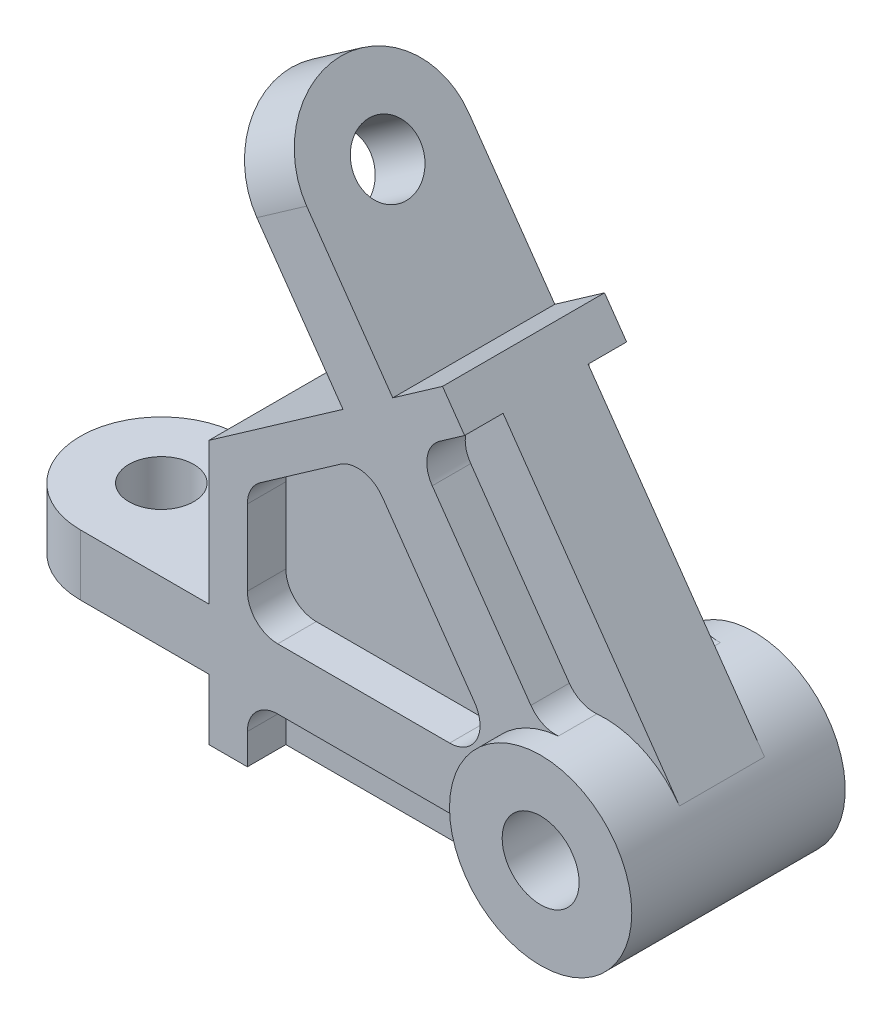
from build123d import *

# Parameters (mm, degrees)
BOSS_EXTRU_1_DEPTH      = 40
ESQUISSE2_R             = 8
ENL_V_MAT_EXTRU_1_DEPTH = 192.268559563
ESQUISSE3_R             = 8
ENL_V_MAT_EXTRU_2_DEPTH = 185.632839971
BOSS_EXTRU_2_DEPTH      = 6.35
BOSS_EXTRU_3_START      = 6.35
BOSS_EXTRU_3_DEPTH      = 6.35
ENL_V_START             = -9.5
ENL_V_MAT_EXTRU_3_DEPTH = 9.5
ENL_V_MAT_EXTRU_4_DEPTH = 9.5


with BuildPart() as part:
    # Esquisse1 → Boss.-Extru.1 (new body)
    with BuildSketch(Plane.XY):
        with BuildLine():
            ThreePointArc((-12.905469818, 18.430920997), (3.907083998, 22.158174443), (18.430920997, 12.905469818))
            Line((18.430920997, 12.905469818), (-30.570908371, 82.887334756))
            Line((-30.570908371, 82.887334756), (-42.858189035, 74.28368821))
            Line((-42.858189035, 74.28368821), (-75.591001848, 121.030989584))
            Line((-75.591001848, 121.030989584), (-81.73464218, 116.729166311))
            Line((-81.73464218, 116.729166311), (-12.905469818, 18.430920997))
        make_face()
        with BuildLine():
            ThreePointArc((-22.5, 0), (-19.957743747, 10.389343798), (-12.905469818, 18.430920997))
            Line((-12.905469818, 18.430920997), (-81.73464218, 116.729166311))
            Line((-81.73464218, 116.729166311), (-87.878282512, 112.427343039))
            Line((-87.878282512, 112.427343039), (-55.1454697, 65.680041665))
            Line((-55.1454697, 65.680041665), (-88.25, 42.5))
            Line((-88.25, 42.5), (-88.25, 7.5))
            Line((-88.25, 7.5), (-140, 7.5))
            Line((-140, 7.5), (-140, 0))
            Line((-140, 0), (-22.5, 0))
        make_face()
        with BuildLine():
            Line((-88.25, -22.560492565), (0.015421683, -22.499994715))
            ThreePointArc((0.015421683, -22.499994715), (-15.904449254, -15.915354031), (-22.5, 0))
            Line((-22.5, 0), (-140, 0))
            Line((-140, 0), (-140, -7.5))
            Line((-140, -7.5), (-88.25, -7.5))
            Line((-88.25, -7.5), (-88.25, -22.560492565))
        make_face()
        with BuildLine():
            ThreePointArc((22.5, 0), (21.458631392, 6.765880489), (18.430920997, 12.905469818))
            ThreePointArc((18.430920997, 12.905469818), (3.907083998, 22.158174443), (-12.905469818, 18.430920997))
            Line((-12.905469818, 18.430920997), (-5.448976145, 7.781944421))
            ThreePointArc((-5.448976145, 7.781944421), (4.386611826, 8.426602915), (9.5, 0))
            ThreePointArc((9.5, 0), (0, -9.5), (-9.5, 0))
            Line((-9.5, 0), (-22.5, 0))
            ThreePointArc((-22.5, 0), (-15.904449254, -15.915354031), (0.015421683, -22.499994715))
            ThreePointArc((0.015421683, -22.499994715), (15.915354031, -15.904449254), (22.5, 0))
        make_face()
        with BuildLine():
            Line((-5.448976145, 7.781944421), (-12.905469818, 18.430920997))
            ThreePointArc((-12.905469818, 18.430920997), (-19.957743747, 10.389343798), (-22.5, 0))
            Line((-22.5, 0), (-9.5, 0))
            ThreePointArc((-9.5, 0), (-8.426602915, 4.386611826), (-5.448976145, 7.781944421))
        make_face()
        with BuildLine():
            ThreePointArc((22.5, 0), (21.458631392, 6.765880489), (18.430920997, 12.905469818))
            ThreePointArc((18.430920997, 12.905469818), (3.907083998, 22.158174443), (-12.905469818, 18.430920997))
            Line((-12.905469818, 18.430920997), (-5.448976145, 7.781944421))
            ThreePointArc((-5.448976145, 7.781944421), (4.386611826, 8.426602915), (9.5, 0))
            ThreePointArc((9.5, 0), (0, -9.5), (-9.5, 0))
            Line((-9.5, 0), (-22.5, 0))
            ThreePointArc((-22.5, 0), (-15.904449254, -15.915354031), (0.015421683, -22.499994715))
            ThreePointArc((0.015421683, -22.499994715), (15.915354031, -15.904449254), (22.5, 0))
        make_face()
        with BuildLine():
            Line((-5.448976145, 7.781944421), (-12.905469818, 18.430920997))
            ThreePointArc((-12.905469818, 18.430920997), (-19.957743747, 10.389343798), (-22.5, 0))
            Line((-22.5, 0), (-9.5, 0))
            ThreePointArc((-9.5, 0), (-8.426602915, 4.386611826), (-5.448976145, 7.781944421))
        make_face()
    extrude(amount=BOSS_EXTRU_1_DEPTH)

    # Esquisse2 → Enlèv. mat.-Extru.1 (cut, through all)
    with BuildSketch(Plane(origin=(6.143640332, 4.301823273, 0), x_dir=(0, 0, -1), z_dir=(0.8191520442889931, 0.5735764363510444, 0))):
        with Locations(Location((-20, 122.5, 0), (0, 0, 90))):
            Circle(ESQUISSE2_R)
        with BuildLine():
            ThreePointArc((-40, 122.5), (-34.142135624, 136.642135624), (-20, 142.5))
            Line((-20, 142.5), (-40, 142.5))
            Line((-40, 142.5), (-40, 122.5))
        make_face()
        with BuildLine():
            ThreePointArc((-20, 142.5), (-5.857864376, 136.642135624), (0, 122.5))
            Line((0, 122.5), (0, 142.5))
            Line((0, 142.5), (-20, 142.5))
        make_face()
    extrude(amount=-ENL_V_MAT_EXTRU_1_DEPTH, mode=Mode.SUBTRACT)

    # Esquisse3 → Enlèv. mat.-Extru.2 (cut, through all)
    with BuildSketch(Plane(origin=(0, 7.5, 0), x_dir=(1, 0, 0), z_dir=(0, 1, 0))):
        with BuildLine():
            ThreePointArc((-140, -20), (-134.142135624, -5.857864376), (-120, 0))
            Line((-120, 0), (-140, 0))
            Line((-140, 0), (-140, -20))
        make_face()
        with BuildLine():
            ThreePointArc((-120, -40), (-134.142135624, -34.142135624), (-140, -20))
            Line((-140, -20), (-140, -40))
            Line((-140, -40), (-120, -40))
        make_face()
        with Locations(Location((-120, -20, 0), (0, 0, 180))):
            Circle(ESQUISSE3_R)
    extrude(amount=-ENL_V_MAT_EXTRU_2_DEPTH, mode=Mode.SUBTRACT)

    # Esquisse4 → Boss.-Extru.2 (add)
    with BuildSketch(Plane.XY.offset(40)):
        with BuildLine():
            ThreePointArc((22.5, 0), (21.458631392, 6.765880489), (18.430920997, 12.905469818))
            ThreePointArc((18.430920997, 12.905469818), (3.907083998, 22.158174443), (-12.905469818, 18.430920997))
            Line((-12.905469818, 18.430920997), (-5.448976145, 7.781944421))
            ThreePointArc((-5.448976145, 7.781944421), (4.386611826, 8.426602915), (9.5, 0))
            ThreePointArc((9.5, 0), (0, -9.5), (-9.5, 0))
            Line((-9.5, 0), (-22.5, 0))
            ThreePointArc((-22.5, 0), (-15.904449254, -15.915354031), (0.015421683, -22.499994715))
            ThreePointArc((0.015421683, -22.499994715), (15.915354031, -15.904449254), (22.5, 0))
        make_face()
        with BuildLine():
            ThreePointArc((22.5, 0), (21.458631392, 6.765880489), (18.430920997, 12.905469818))
            ThreePointArc((18.430920997, 12.905469818), (3.907083998, 22.158174443), (-12.905469818, 18.430920997))
            Line((-12.905469818, 18.430920997), (-5.448976145, 7.781944421))
            ThreePointArc((-5.448976145, 7.781944421), (4.386611826, 8.426602915), (9.5, 0))
            ThreePointArc((9.5, 0), (0, -9.5), (-9.5, 0))
            Line((-9.5, 0), (-22.5, 0))
            ThreePointArc((-22.5, 0), (-15.904449254, -15.915354031), (0.015421683, -22.499994715))
            ThreePointArc((0.015421683, -22.499994715), (15.915354031, -15.904449254), (22.5, 0))
        make_face()
        with BuildLine():
            Line((-5.448976145, 7.781944421), (-12.905469818, 18.430920997))
            ThreePointArc((-12.905469818, 18.430920997), (-19.957743747, 10.389343798), (-22.5, 0))
            Line((-22.5, 0), (-9.5, 0))
            ThreePointArc((-9.5, 0), (-8.426602915, 4.386611826), (-5.448976145, 7.781944421))
        make_face()
    extrude(amount=BOSS_EXTRU_2_DEPTH)

    # Esquisse5 → Boss.-Extru.3 (add)
    with BuildSketch(Plane(origin=(0, 0, 0), x_dir=(-1, 0, 0), z_dir=(0, 0, -1)).offset(BOSS_EXTRU_3_START)):
        with BuildLine():
            ThreePointArc((12.905469818, 18.430920997), (-3.907083998, 22.158174443), (-18.430920997, 12.905469818))
            ThreePointArc((-18.430920997, 12.905469818), (-19.961303045, -10.382503588), (-0.015421683, -22.499994715))
            ThreePointArc((-0.015421683, -22.499994715), (15.904449254, -15.915354031), (22.5, 0))
            Line((22.5, 0), (9.5, 0))
            ThreePointArc((9.5, 0), (-8.426602915, -4.386611826), (5.448976145, 7.781944421))
            Line((5.448976145, 7.781944421), (12.905469818, 18.430920997))
        make_face()
        with BuildLine():
            ThreePointArc((22.5, 0), (19.957743747, 10.389343798), (12.905469818, 18.430920997))
            Line((12.905469818, 18.430920997), (5.448976145, 7.781944421))
            ThreePointArc((5.448976145, 7.781944421), (8.426602915, 4.386611826), (9.5, 0))
            Line((9.5, 0), (22.5, 0))
        make_face()
        with BuildLine():
            ThreePointArc((12.905469818, 18.430920997), (-3.907083998, 22.158174443), (-18.430920997, 12.905469818))
            ThreePointArc((-18.430920997, 12.905469818), (-19.961303045, -10.382503588), (-0.015421683, -22.499994715))
            ThreePointArc((-0.015421683, -22.499994715), (15.904449254, -15.915354031), (22.5, 0))
            Line((22.5, 0), (9.5, 0))
            ThreePointArc((9.5, 0), (-8.426602915, -4.386611826), (5.448976145, 7.781944421))
            Line((5.448976145, 7.781944421), (12.905469818, 18.430920997))
        make_face()
    extrude(amount=-BOSS_EXTRU_3_DEPTH)

    # Esquisse6 → Enlèv. mat.-Extru.3 (cut)
    with BuildSketch(Plane.XY.offset(40).offset(ENL_V_START)):
        with BuildLine():
            Line((18.430920997, 12.905469818), (-25.121932226, 75.105390335))
            Line((-25.121932226, 75.105390335), (-31.265572558, 70.803567062))
            ThreePointArc((-31.265572558, 70.803567062), (-34.349807433, 65.962288063), (-33.107389617, 60.358103458))
            Line((-33.107389617, 60.358103458), (-8.758312615, 25.58401767))
            ThreePointArc((-8.758312615, 25.58401767), (-5.784309245, 23.08853254), (-1.961004212, 22.414380707))
            ThreePointArc((-1.961004212, 22.414380707), (9.508910889, 20.391925208), (18.430920997, 12.905469818))
        make_face()
        with BuildLine():
            Line((-78.75, -22.553981187), (0.015421683, -22.499994715))
            ThreePointArc((0.015421683, -22.499994715), (-11.243321555, -19.489425862), (-19.485571585, -11.25))
            ThreePointArc((-19.485571585, -11.25), (-22.230762114, -8.504809472), (-25.980762114, -7.5))
            Line((-25.980762114, -7.5), (-71.25, -7.5))
            ThreePointArc((-71.25, -7.5), (-76.553300859, -9.696699141), (-78.75, -15))
            Line((-78.75, -15), (-78.75, -22.553981187))
        make_face()
        with BuildLine():
            Line((-22.671091572, 19.301823273), (-45.394670282, 51.754456912))
            ThreePointArc((-45.394670282, 51.754456912), (-50.235949281, 54.838691787), (-55.840133886, 53.596273972))
            Line((-55.840133886, 53.596273972), (-75.551823273, 39.794000473))
            ThreePointArc((-75.551823273, 39.794000473), (-77.902581249, 37.11347474), (-78.75, 33.650360141))
            Line((-78.75, 33.650360141), (-78.75, 15))
            ThreePointArc((-78.75, 15), (-76.553300859, 9.696699141), (-71.25, 7.5))
            Line((-71.25, 7.5), (-28.814731905, 7.5))
            ThreePointArc((-28.814731905, 7.5), (-22.162150656, 11.536885401), (-22.671091572, 19.301823273))
        make_face()
    extrude(amount=ENL_V_MAT_EXTRU_3_DEPTH, mode=Mode.SUBTRACT)

    # Esquisse7 → Enlèv. mat.-Extru.4 (cut)
    with BuildSketch(Plane(origin=(0, 0, 0), x_dir=(-1, 0, 0), z_dir=(0, 0, -1))):
        with BuildLine():
            Line((25.980762114, -7.5), (71.25, -7.5))
            ThreePointArc((71.25, -7.5), (76.553300859, -9.696699141), (78.75, -15))
            Line((78.75, -15), (78.75, -22.553981187))
            Line((78.75, -22.553981187), (-0.015421683, -22.499994715))
            ThreePointArc((-0.015421683, -22.499994715), (11.243321555, -19.489425862), (19.485571585, -11.25))
            ThreePointArc((19.485571585, -11.25), (22.230762114, -8.504809472), (25.980762114, -7.5))
        make_face()
        with BuildLine():
            Line((33.107389617, 60.358103458), (8.758312615, 25.58401767))
            ThreePointArc((8.758312615, 25.58401767), (5.784309245, 23.08853254), (1.961004212, 22.414380707))
            ThreePointArc((1.961004212, 22.414380707), (-9.508910889, 20.391925208), (-18.430920997, 12.905469818))
            Line((-18.430920997, 12.905469818), (25.121932226, 75.105390335))
            Line((25.121932226, 75.105390335), (31.265572558, 70.803567062))
            ThreePointArc((31.265572558, 70.803567062), (34.349807433, 65.962288063), (33.107389617, 60.358103458))
        make_face()
        with BuildLine():
            Line((78.75, 33.650360141), (78.75, 15))
            ThreePointArc((78.75, 15), (76.553300859, 9.696699141), (71.25, 7.5))
            Line((71.25, 7.5), (28.814731905, 7.5))
            ThreePointArc((28.814731905, 7.5), (22.162150656, 11.536885401), (22.671091572, 19.301823273))
            Line((22.671091572, 19.301823273), (45.394670282, 51.754456912))
            ThreePointArc((45.394670282, 51.754456912), (50.235949281, 54.838691787), (55.840133886, 53.596273972))
            Line((55.840133886, 53.596273972), (75.551823273, 39.794000473))
            ThreePointArc((75.551823273, 39.794000473), (77.902581249, 37.11347474), (78.75, 33.650360141))
        make_face()
    extrude(amount=-ENL_V_MAT_EXTRU_4_DEPTH, mode=Mode.SUBTRACT)


solid = part.part
